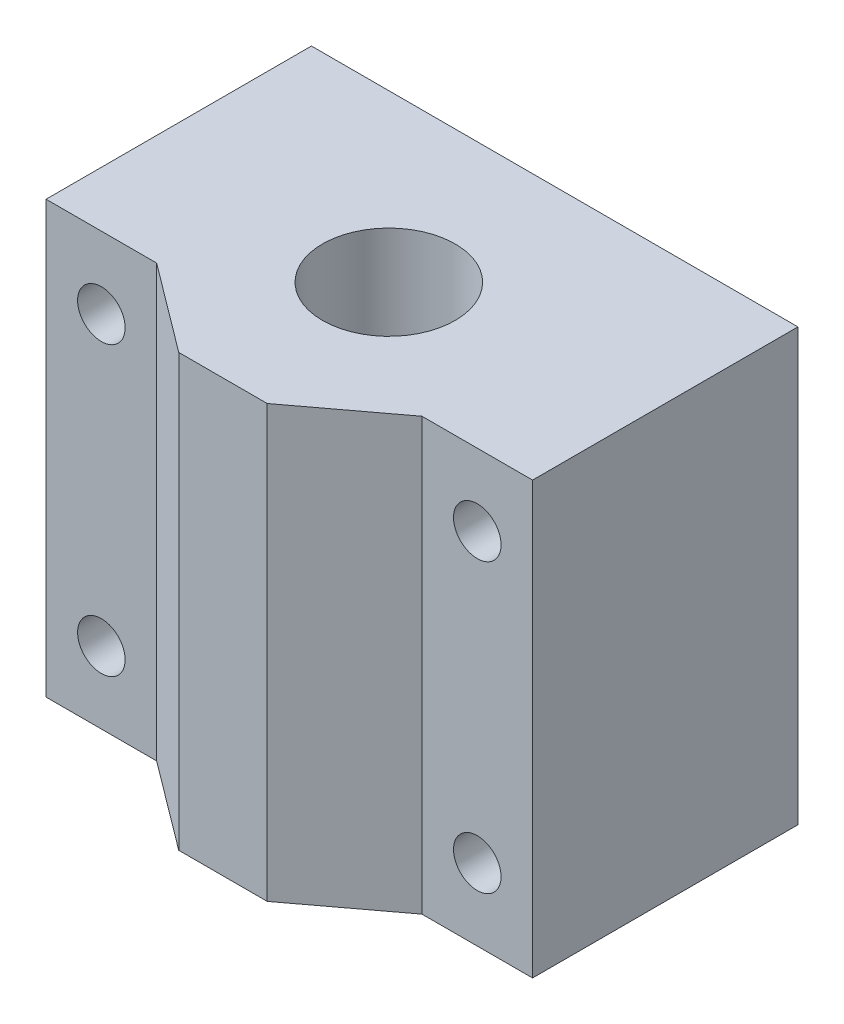
from build123d import *

# Parameters (mm, degrees)
SKETCH1_R           = 6
BOSS_EXTRUDE1_DEPTH = 39
SKETCH2_R           = 2.15
CUT_EXTRUDE1_DEPTH  = 52.06627412


with BuildPart() as part:
    # Sketch1 → Boss-Extrude1 (new body)
    with BuildSketch(Plane(origin=(0, 0, 0), x_dir=(1, 0, 0), z_dir=(0, 1, 0))):
        Polygon((21.399903705, 28.649644043), (-22.600096295, 28.649644043), (-22.600096295, 4.649644043), (-12.600096295, 4.649644043), (-4.600096295, -1.350355957), (3.399903705, -1.350355957), (11.399903705, 4.649644043), (21.399903705, 4.649644043), align=None)
        with Locations(Location((-0.600096295, 13.649644043, 0), (0, 0, 270))):
            Circle(SKETCH1_R, mode=Mode.SUBTRACT)
    extrude(amount=BOSS_EXTRUDE1_DEPTH)

    # Sketch2 → Cut-Extrude1 (cut, through all)
    with BuildSketch(Plane.XY.offset(-4.649644043)):
        with Locations((-17.600096295, 32.5)):
            Circle(SKETCH2_R)
        with Locations((-17.600096295, 6.5)):
            Circle(SKETCH2_R)
        with Locations(Location((16.399903705, 6.5, 0), (0, 0, 180))):
            Circle(SKETCH2_R)
        with Locations(Location((16.399903705, 32.5, 0), (0, 0, 180))):
            Circle(SKETCH2_R)
    extrude(amount=-CUT_EXTRUDE1_DEPTH, mode=Mode.SUBTRACT)


solid = part.part
